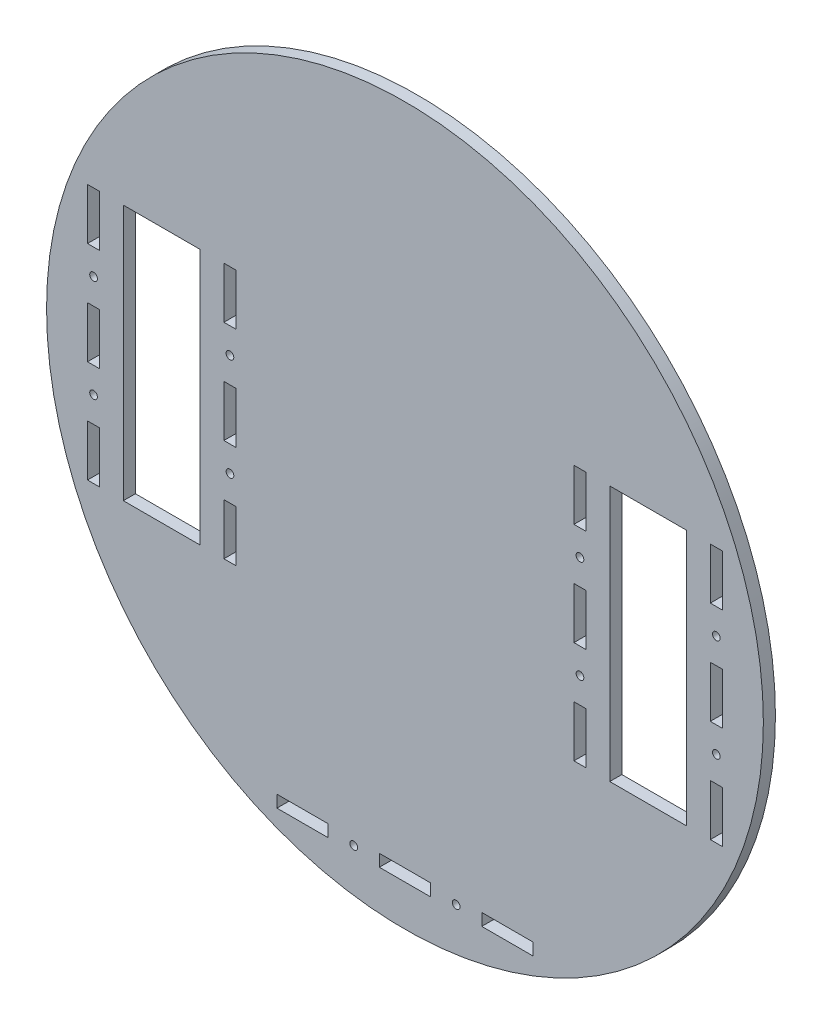
from build123d import *

# Parameters (mm, degrees)
SKETCH1_R           = 177.8
BOSS_EXTRUDE1_DEPTH = 5.9944
SKETCH3_R           = 1.905
SKETCH3_W           = 5.9944
SKETCH3_H           = 25.4
SKETCH3_W_2         = 38.1
SKETCH3_H_2         = 127
SKETCH3_W_3         = 25.4
SKETCH3_H_3         = 5.9944
CUT_EXTRUDE1_DEPTH  = 5.9944


with BuildPart() as part:
    # Sketch1 → Boss-Extrude1 (new body)
    with BuildSketch(Plane.XY):
        with Locations(Location((0, 0, 0), (0, 0, 180))):
            Circle(SKETCH1_R)
    extrude(amount=BOSS_EXTRUDE1_DEPTH)

    # Sketch3 → Cut-Extrude1 (cut)
    with BuildSketch(Plane.XY.offset(5.9944)):
        with Locations((-154.4828, 25.4)):
            Circle(SKETCH3_R)
        with Locations((-154.4828, -25.4)):
            Circle(SKETCH3_R)
        with Locations((-86.8172, -25.4)):
            Circle(SKETCH3_R)
        with Locations((-86.8172, 25.4)):
            Circle(SKETCH3_R)
        with Locations((86.8172, -25.4)):
            Circle(SKETCH3_R)
        with Locations((154.4828, -25.4)):
            Circle(SKETCH3_R)
        with Locations((86.8172, 25.4)):
            Circle(SKETCH3_R)
        with Locations((154.4828, 25.4)):
            Circle(SKETCH3_R)
        with Locations((-25.4, -154.4828)):
            Circle(SKETCH3_R)
        with Locations((25.4, -154.4828)):
            Circle(SKETCH3_R)
        with Locations((-154.4828, -50.8)):
            Rectangle(SKETCH3_W, SKETCH3_H)
        with Locations((-120.65, 0)):
            Rectangle(SKETCH3_W_2, SKETCH3_H_2)
        with Locations((-154.4828, 50.8)):
            Rectangle(SKETCH3_W, SKETCH3_H)
        with Locations((-154.4828, 0)):
            Rectangle(SKETCH3_W, SKETCH3_H)
        with Locations((154.4828, 0)):
            Rectangle(SKETCH3_W, SKETCH3_H)
        with Locations((154.4828, -50.8)):
            Rectangle(SKETCH3_W, SKETCH3_H)
        with Locations((154.4828, 50.8)):
            Rectangle(SKETCH3_W, SKETCH3_H)
        with Locations((120.65, 0)):
            Rectangle(SKETCH3_W_2, SKETCH3_H_2)
        with Locations((-86.8172, 0)):
            Rectangle(SKETCH3_W, SKETCH3_H)
        with Locations((-86.8172, -50.8)):
            Rectangle(SKETCH3_W, SKETCH3_H)
        with Locations((-86.8172, 50.8)):
            Rectangle(SKETCH3_W, SKETCH3_H)
        with Locations((86.8172, -50.8)):
            Rectangle(SKETCH3_W, SKETCH3_H)
        with Locations((86.8172, 50.8)):
            Rectangle(SKETCH3_W, SKETCH3_H)
        with Locations((86.8172, 0)):
            Rectangle(SKETCH3_W, SKETCH3_H)
        with Locations((50.8, -154.4828)):
            Rectangle(SKETCH3_W_3, SKETCH3_H_3)
        with Locations((-50.8, -154.4828)):
            Rectangle(SKETCH3_W_3, SKETCH3_H_3)
        with Locations((0, -154.4828)):
            Rectangle(SKETCH3_W_3, SKETCH3_H_3)
    extrude(amount=-CUT_EXTRUDE1_DEPTH, mode=Mode.SUBTRACT)


solid = part.part
